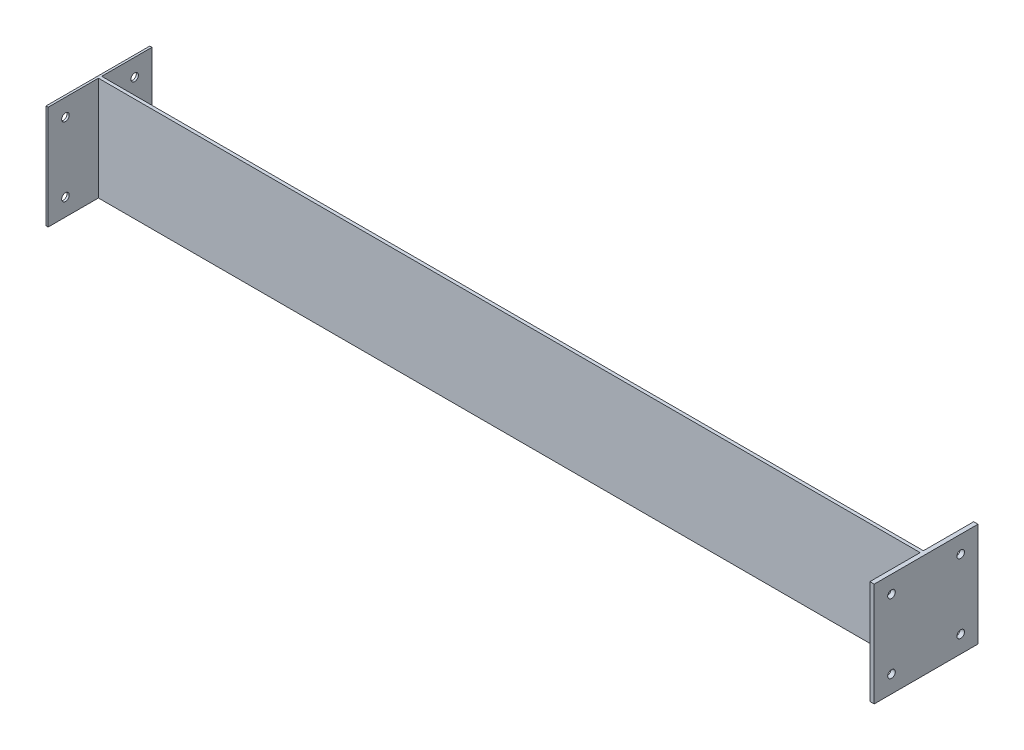
from build123d import *

# Parameters (mm, degrees)
SKETCH1_W           = 152.4
SKETCH1_H           = 152.4
BOSS_EXTRUDE1_DEPTH = 3.175
SKETCH2_W           = 4.7625
SKETCH2_H           = 152.4
BOSS_EXTRUDE2_DEPTH = 1206.5
SKETCH3_W           = 152.4
SKETCH3_H           = 152.4
BOSS_EXTRUDE3_DEPTH = 6.35
SKETCH4_R           = 5.55625
CUT_EXTRUDE1_DEPTH  = 1219.2


with BuildPart() as part:
    # Sketch1 → Boss-Extrude1 (new body)
    with BuildSketch(Plane(origin=(0, 0, 0), x_dir=(0, 0, -1), z_dir=(1, 0, 0))):
        with Locations((76.2, 76.2)):
            Rectangle(SKETCH1_W, SKETCH1_H)
    extrude(amount=BOSS_EXTRUDE1_DEPTH)

    # Sketch2 → Boss-Extrude2 (add)
    with BuildSketch(Plane(origin=(3.175, 0, 0), x_dir=(0, 0, -1), z_dir=(1, 0, 0))):
        with Locations((76.2, 76.2)):
            Rectangle(SKETCH2_W, SKETCH2_H)
    extrude(amount=BOSS_EXTRUDE2_DEPTH)

    # Sketch3 → Boss-Extrude3 (add)
    with BuildSketch(Plane(origin=(1209.675, 0, 0), x_dir=(0, 0, -1), z_dir=(1, 0, 0))):
        with Locations((76.2, 76.2)):
            Rectangle(SKETCH3_W, SKETCH3_H)
    extrude(amount=BOSS_EXTRUDE3_DEPTH)

    # Sketch4 → Cut-Extrude1 (cut)
    with BuildSketch(Plane.ZY):
        with Locations((-127, 127)):
            Circle(SKETCH4_R)
        with Locations((-25.4, 127)):
            Circle(SKETCH4_R)
        with Locations((-25.4, 25.4)):
            Circle(SKETCH4_R)
        with Locations((-127, 25.4)):
            Circle(SKETCH4_R)
    extrude(amount=-CUT_EXTRUDE1_DEPTH, mode=Mode.SUBTRACT)


solid = part.part
